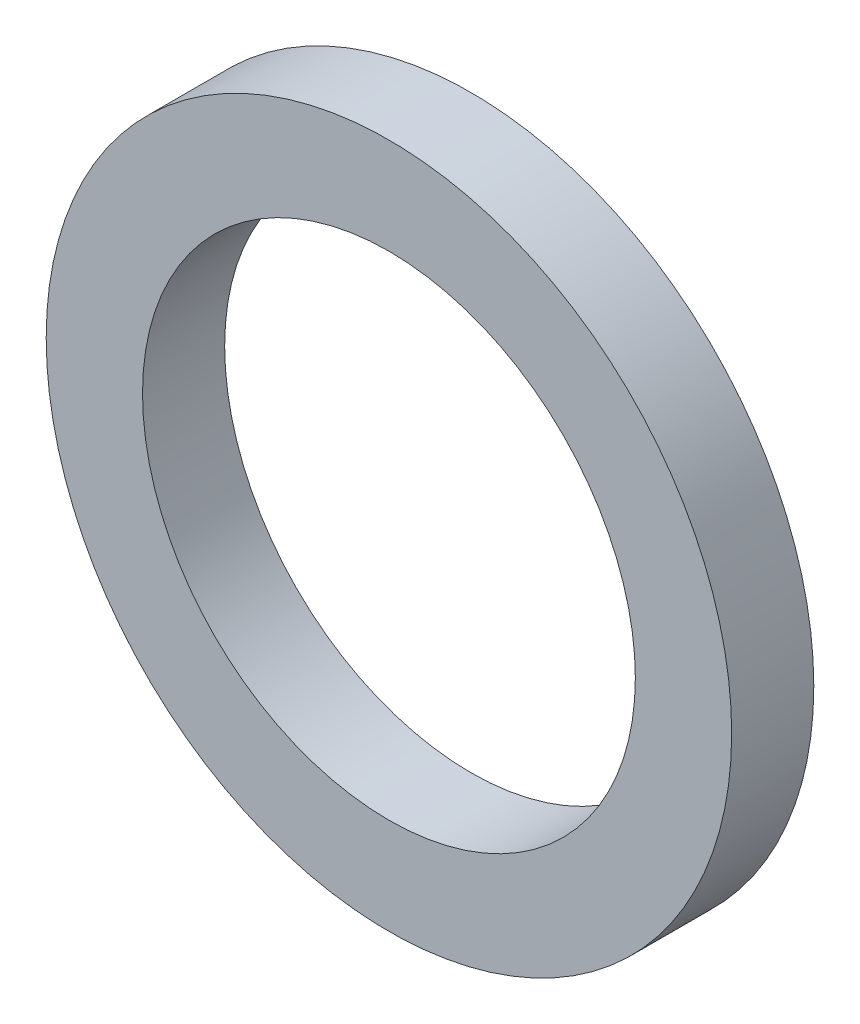
from build123d import *

# Parameters (mm, degrees)
SKETCH1_R           = 6.62432
SKETCH1_R_2         = 4.7625
BOSS_EXTRUDE1_DEPTH = 0.79375


with BuildPart() as part:
    # Sketch1 → Boss-Extrude1 (new, symmetric)
    with BuildSketch(Plane.XY):
        Circle(SKETCH1_R)
        Circle(SKETCH1_R_2, mode=Mode.SUBTRACT)
    extrude(amount=BOSS_EXTRUDE1_DEPTH, both=True)


solid = part.part
